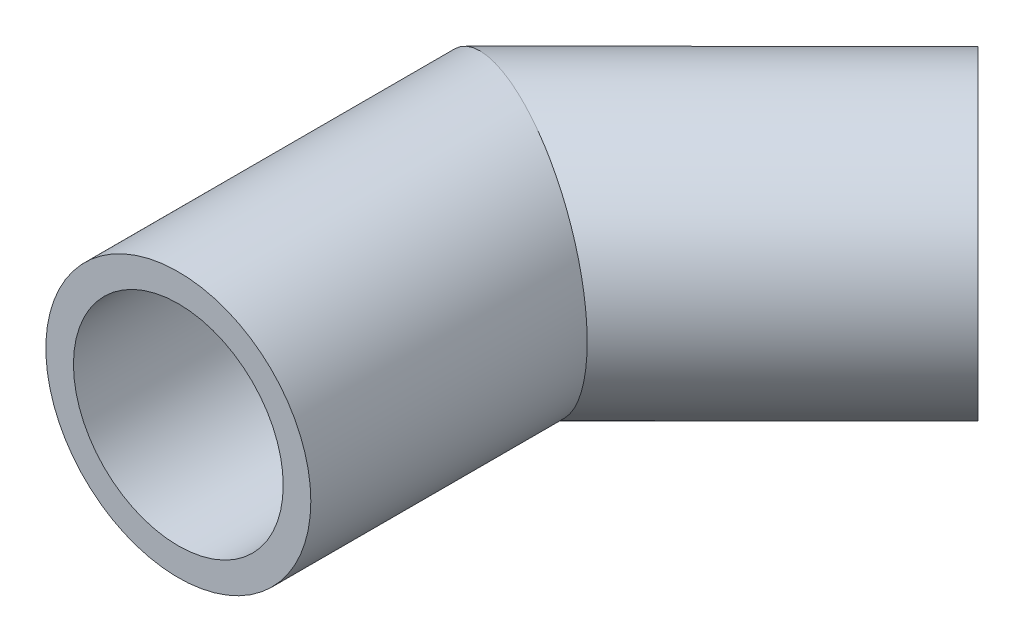
from build123d import *

# Parameters (mm, degrees)
SKETCH3_R   = 30.48
SKETCH3_R_2 = 24.13


with BuildPart() as part:
    # Sweep1: sweep along a path in Sketch2
    with BuildLine(Plane(origin=(0, 0, 0), x_dir=(1, 0, 0), z_dir=(0, 1, 0))) as sweep1_path:
        Line((0, 0), (0, 76.2))
        Line((0, 76.2), (53.881536726, 130.081536726))
    # Sketch3 → Sweep1 (sweep)
    with BuildSketch(Plane.XY):
        Circle(SKETCH3_R)
        Circle(SKETCH3_R_2, mode=Mode.SUBTRACT)
    sweep(path=sweep1_path.line, transition=Transition.RIGHT)


solid = part.part
